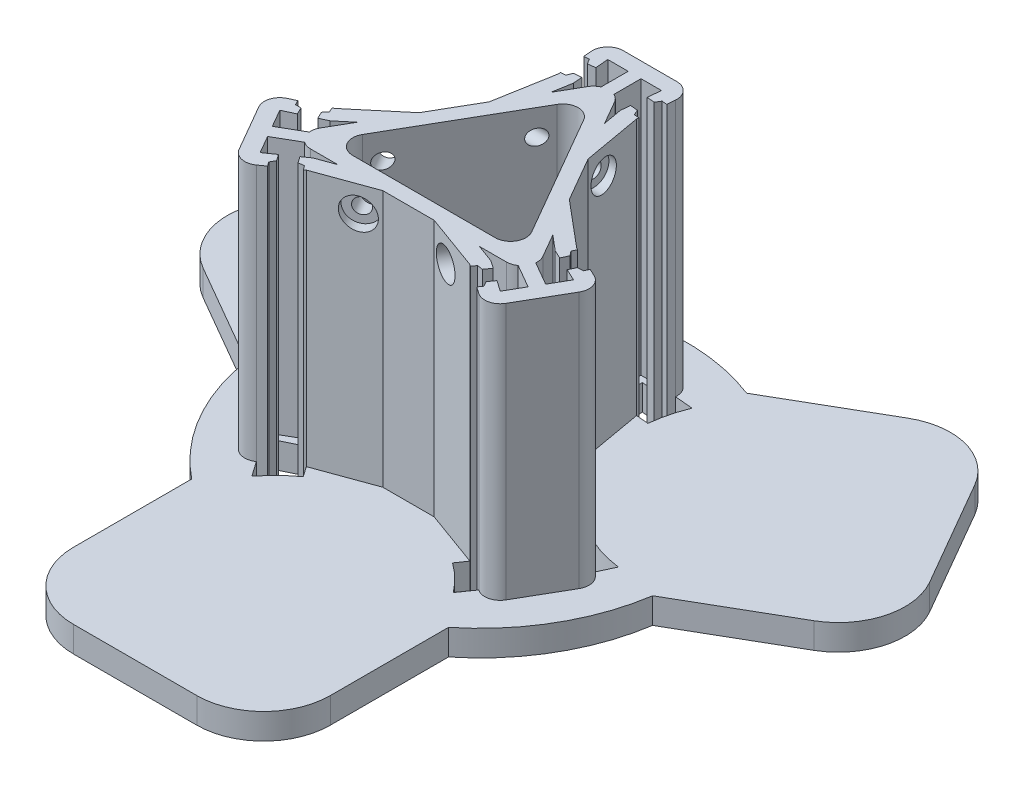
from build123d import *

# Parameters (mm, degrees)
SKETCH_1_R                         = 40
EXTRUDE_1_DEPTH                    = 5
EXTRUDE_2_DEPTH                    = 50
FILLET_1_R                         = 13
FILLET_2_R                         = 3
SKETCH_6_R                         = 3.4999999999999996
SKETCH_6_R_2                       = 1.5000000000000009
SKETCH_6_R_3                       = 1.5000000000000007
CUT_EXTRUDE_1_DEPTH                = 5
FILLET_3_R                         = 3
SKETCH_7_R                         = 1.5000000000000009
CUT_EXTRUDE_2_DEPTH                = 10
SKETCH_9_R                         = 3.0000000000000018
CUT_EXTRUDE_3_DEPTH                = 10
PATTERN_CIRCULAR_1_COUNT           = 3
PATTERN_CIRCULAR_1_COPY_1_SKETCH_R = 3.0000000000000018
PATTERN_CIRCULAR_1_COPY_1_DEPTH    = 10
PATTERN_CIRCULAR_1_COPY_2_SKETCH_R = 3.0000000000000018
PATTERN_CIRCULAR_1_COPY_2_DEPTH    = 10
CUT_EXTRUDE_4_DEPTH                = 10
CHAMFER_1_SIZE                     = 2
EXTRUDE_3_DEPTH                    = 50
CUT_EXTRUDE_5_DEPTH                = 50
CUT_EXTRUDE_6_DEPTH                = 5
PATTERN_CIRCULAR_2_COUNT           = 3


with BuildPart() as part:
    # 草图1 → 凸台-拉伸1 (new body)
    with BuildSketch(Plane(origin=(0, 0, 0), x_dir=(1, 0, 0), z_dir=(0, 1, 0))):
        Circle(SKETCH_1_R)
        with BuildLine():
            Line((-70.71854910221971, 11.961859901384987), (-39.54163456597992, -6.038140098614985))
            ThreePointArc((-39.54163456597992, -6.038140098614977), (-34.64101615137755, 19.999999999999996), (-14.541634565979926, 37.26313009060696))
            Line((-14.541634565979923, 37.26313009060696), (-45.71854910221971, 55.26313009060694))
            Line((-45.71854910221971, 55.26313009060694), (-70.71854910221971, 11.961859901384988))
        make_face()
        with BuildLine():
            ThreePointArc((40, -9.8e-15), (39.88524402983638, -3.0277563773199354), (39.54163456597992, -6.038140098614973))
            Line((39.54163456597992, -6.038140098614959), (70.7185491022197, 11.96185990138505))
            Line((70.7185491022197, 11.961859901385054), (45.71854910221967, 55.263130090606985))
            Line((45.71854910221967, 55.26313009060698), (14.541634565979898, 37.26313009060697))
            ThreePointArc((14.541634565979898, 37.26313009060697), (33.02775637731994, 22.564735954147615), (40, 0))
        make_face()
        with BuildLine():
            ThreePointArc((25, -31.22498999199199), (-7.35e-15, -40), (-25.000000000000007, -31.224989991991983))
            Line((-25.000000000000004, -31.224989991991986), (-25, -67.22498999199198))
            Line((-25, -67.22498999199198), (25.000000000000014, -67.22498999199198))
            Line((25.000000000000014, -67.22498999199198), (25.000000000000004, -31.224989991991986))
        make_face()
    extrude(amount=EXTRUDE_1_DEPTH)

    # 草图3 → 凸台-拉伸2 (add)
    with BuildSketch(Plane(origin=(0, 5, 0), x_dir=(1, 0, 0), z_dir=(0, 1, 0))):
        Polygon((5.0000000000000036, -13.999999999999723), (13.771413200489384, -13.999999999999677), (5.528980942125376, -10.999999999999721), (-5.528980942125042, -10.999999999999783), (-13.771413200488723, -13.999999999999824), (-4.999999999999709, -13.999999999999774), align=None)
        Polygon((23.529502776556207, -4.802432685892536), (14.624355652981862, 2.6698729810779707), (19.01006225322692, -4.926393677636174), (21.903694940095285, -7.354439797949879), (28.59379936192919, -10.474086723707572), (23.36772486513708, -19.525913276291682), (17.32097916567585, -15.291936355891886), (13.771413200489386, -13.999999999999673), (5.0000000000000036, -13.999999999999723), (15.923780094226146, -17.97593079996756), (24.32883832488654, -23.86121593216739), (32.8288383248864, -9.138784067831828), align=None)
        Polygon((-19.01006225322658, -4.926393677636355), (-14.62435565298191, 2.6698729810776634), (-23.5295027765561, -4.802432685893031), (-32.828838324886206, -9.1387840678325), (-24.328838324886046, -23.861215932167887), (-15.923780094225767, -17.975930799967895), (-4.999999999999709, -13.999999999999845), (-13.771413200488727, -13.99999999999982), (-17.32097916567553, -15.291936355892252), (-23.36772486513667, -19.525913276292176), (-28.593799361928973, -10.47408672370817), (-21.90369494009513, -7.354439797950335), align=None)
        Polygon((-6.761788970566114, 10.2882379529202), (-5.2386490527376175, 18.926393677635538), (-9.624355652982096, 11.330127018921829), (-14.62435565298191, 2.6698729810776634), (-19.01006225322658, -4.926393677636355), (-12.290769912691273, 0.7117620470792656), align=None)
        Polygon((5.238649052737051, 18.926393677636717), (9.624355652982118, 11.330127018922184), (7.605722682329952, 22.778363485860595), (8.499999999999662, 32.9999999999999), (-8.500000000000359, 32.99999999999971), (-7.605722682330446, 22.778363485860424), (-9.624355652982153, 11.330127018921862), (-5.238649052737607, 18.92639367763554), (-4.582715774419748, 22.646376153842155), (-5.22607449679251, 29.999999999999748), (5.226074496791905, 29.999999999999854), (4.58271577441929, 22.64637615384222), align=None)
        Polygon((14.624355652982025, 2.6698729810780613), (9.624355652982118, 11.330127018922184), (5.238649052737051, 18.926393677636717), (6.761788970565958, 10.288237952920133), (12.290769912691639, 0.7117620470792474), (19.01006225322692, -4.926393677636167), align=None)
        Polygon((24.248711305964207, -13.99999999999962), (19.01006225322692, -4.926393677636174), (12.2907699126916, 0.7117620470792195), (19.052558883257564, -10.999999999999648), (5.528980942125376, -10.999999999999725), (13.771413200489386, -13.999999999999673), align=None)
        Polygon((-19.0525588832572, -10.999999999999856), (-12.290769912691294, 0.7117620470792758), (-19.01006225322658, -4.926393677636359), (-24.248711305963784, -13.999999999999876), (-13.771413200488727, -13.99999999999982), (-5.528980942125043, -10.999999999999785), align=None)
        Polygon((6.761788970565958, 10.288237952920133), (5.2386490527370455, 18.926393677636717), (0, 27.999999999999755), (-5.238649052737607, 18.92639367763554), (-6.761788970566114, 10.2882379529202), (2.132e-14, 21.999999999999766), align=None)
    extrude(amount=EXTRUDE_2_DEPTH)

    # 圆角1
    fillet_1_edges = [part.edges().sort_by_distance(p)[0] for p in [
        (25.000000000000014, 2.5, 67.22498999199198),
        (-25, 2.5, 67.22498999199198),
        (-70.71854910221971, 2.5, -11.961859901384987),
        (-45.71854910221971, 2.5, -55.26313009060694),
        (45.71854910221967, 2.5, -55.26313009060698),
        (70.7185491022197, 2.5, -11.961859901385052),
    ]]
    fillet(fillet_1_edges, radius=FILLET_1_R)

    # 圆角2
    fillet_2_edges = [part.edges().sort_by_distance(p)[0] for p in [
        (24.248711305964207, 30, 13.99999999999962),
        (-24.248711305963784, 30, 13.999999999999876),
        (-19.0525588832572, 30, 10.999999999999856),
        (2.172e-14, 30, -21.999999999999766),
        (0, 30, -27.999999999999755),
        (19.052558883257564, 30, 10.99999999999965),
    ]]
    fillet(fillet_2_edges, radius=FILLET_2_R)

    # 草图6 → 切除-拉伸1 (cut)
    with BuildSketch(Plane.XZ):
        with Locations(Location((0, 0, 0), (0, 0, 270))):
            Circle(SKETCH_6_R)
        with Locations(Location((0, 6.999999999999999, 0), (0, 0, 270))):
            Circle(SKETCH_6_R_2)
        with Locations(Location((6.999999999999999, 0, 0), (0, 0, 270))):
            Circle(SKETCH_6_R_3)
        with Locations(Location((-6.999999999999999, 0, 0), (0, 0, 90))):
            Circle(SKETCH_6_R_3)
        with Locations(Location((0, -6.999999999999999, 0), (0, 0, 90))):
            Circle(SKETCH_6_R_2)
    extrude(amount=-CUT_EXTRUDE_1_DEPTH, mode=Mode.SUBTRACT)

    # 圆角3
    fillet_3_edges = [part.edges().sort_by_distance(p)[0] for p in [
        (-32.828838324886206, 30, 9.1387840678325),
        (-24.328838324886046, 30, 23.861215932167887),
        (24.32883832488654, 30, 23.86121593216739),
        (32.8288383248864, 30, 9.138784067831828),
        (8.499999999999662, 30, -32.9999999999999),
        (-8.500000000000359, 30, -32.99999999999971),
    ]]
    fillet(fillet_3_edges, radius=FILLET_3_R)

    # 草图7 → 切除-拉伸2 (cut, symmetric)
    with BuildSketch(Plane(origin=(0, 0, 0), x_dir=(0, 0, -1), z_dir=(1, 0, 0))):
        with Locations((15, 50)):
            Circle(SKETCH_7_R)
    cut_extrude_2 = extrude(amount=CUT_EXTRUDE_2_DEPTH, both=True, mode=Mode.SUBTRACT)

    # 草图9 → 切除-拉伸3 (cut)
    with BuildSketch(Plane(origin=(7, 0, 0), x_dir=(0, 0, -1), z_dir=(1, 0, 0))):
        with Locations((15, 50)):
            Circle(SKETCH_9_R)
    cut_extrude_3 = extrude(amount=CUT_EXTRUDE_3_DEPTH, mode=Mode.SUBTRACT)

    # 镜向1: 切除-拉伸3 across plane
    add(cut_extrude_3.mirror(Plane(origin=(0, 0, 0), x_dir=(0, 0, 1), z_dir=(1, 0, 0))), mode=Mode.SUBTRACT)

    # 阵列(圆周)1: 切除-拉伸2, 切除-拉伸3 ×3 about axis
    pattern_circular_1_axis = Axis((-2.9e-16, 0, 1.5e-15), (0, 1, 0))
    add([cut_extrude_2.rotate(pattern_circular_1_axis, i * 360 / PATTERN_CIRCULAR_1_COUNT) for i in range(1, PATTERN_CIRCULAR_1_COUNT)], mode=Mode.SUBTRACT)
    add([cut_extrude_3.rotate(pattern_circular_1_axis, i * 360 / PATTERN_CIRCULAR_1_COUNT) for i in range(1, PATTERN_CIRCULAR_1_COUNT)], mode=Mode.SUBTRACT)

    # 阵列(圆周)1 copy 1 sketch → 阵列(圆周)1 copy 1 (cut)
    with BuildSketch(Plane(origin=(3.4999999999999964, 0, 6.062177826491073), x_dir=(-0.8660254037844387, 0, 0.4999999999999998), z_dir=(0.4999999999999998, 0, 0.8660254037844387))):
        with Locations((15, -50)):
            Circle(PATTERN_CIRCULAR_1_COPY_1_SKETCH_R)
    extrude(amount=PATTERN_CIRCULAR_1_COPY_1_DEPTH, mode=Mode.SUBTRACT)

    # 阵列(圆周)1 copy 2 sketch → 阵列(圆周)1 copy 2 (cut)
    with BuildSketch(Plane(origin=(3.500000000000004, 0, -6.062177826491066), x_dir=(0.8660254037844384, 0, 0.5000000000000004), z_dir=(0.5000000000000004, 0, -0.8660254037844384))):
        with Locations((15, -50)):
            Circle(PATTERN_CIRCULAR_1_COPY_2_SKETCH_R)
    extrude(amount=PATTERN_CIRCULAR_1_COPY_2_DEPTH, mode=Mode.SUBTRACT)

    # 草图10 → 切除-拉伸4 (cut)
    with BuildSketch(Plane(origin=(0, 5, 0), x_dir=(1, 0, 0), z_dir=(0, 1, 0))):
        Polygon((-1.3323e-13, 13.49999999999977), (4.9074772881116235, 13.499999999999817), (2.598076211353357, 17.499999999999794), (-1.7897e-13, 17.499999999999776), align=None)
        Polygon((-4.907477288111908, 13.499999999999725), (-1.3323e-13, 13.49999999999977), (-1.7884e-13, 17.499999999999776), (-2.5980762113532716, 17.499999999999762), align=None)
        Polygon((11.691342951089823, -6.749999999999692), (15.155444566227587, -8.749999999999675), (16.454482671904234, -6.499999999999671), (14.145081595145635, -2.4999999999997904), align=None)
        Polygon((13.856406460550941, -10.99999999999968), (15.155444566227587, -8.749999999999677), (11.691342951089823, -6.749999999999692), (9.23760430703387, -10.999999999999815), align=None)
        Polygon((-15.155444566227395, -8.750000000000039), (-11.691342951089664, -6.750000000000001), (-14.145081595145575, -2.5000000000000746), (-16.4544826719039, -6.499999999999838), align=None)
        Polygon((-13.856406460550563, -10.99999999999983), (-9.23760430703373, -10.999999999999936), (-11.691342951089657, -6.7499999999999964), (-15.155444566227395, -8.750000000000039), align=None)
        with BuildLine():
            Line((-16.4544826719039, -6.499999999999838), (-13.856406460550563, -10.99999999999983))
            ThreePointArc((-13.856406460550563, -10.99999999999983), (-16.454482671903886, -9.499999999999838), (-16.4544826719039, -6.499999999999838))
        make_face()
        with BuildLine():
            ThreePointArc((13.856406460550941, -10.99999999999968), (15.356406460550899, -10.598076211353012), (16.454482671904202, -9.499999999999748))
            Line((16.45448267190422, -9.499999999999712), (15.155444566227555, -8.749999999999726))
            Line((15.155444566227587, -8.749999999999677), (13.856406460550941, -10.99999999999968))
        make_face()
        with BuildLine():
            Line((15.155444566227555, -8.749999999999726), (16.45448267190422, -9.499999999999712))
            ThreePointArc((16.454482671904202, -9.499999999999748), (16.856406460550925, -7.999999999999714), (16.454482671904234, -6.499999999999671))
            Line((16.454482671904234, -6.499999999999671), (15.155444566227587, -8.749999999999677))
        make_face()
        with BuildLine():
            ThreePointArc((13.856406460550941, -10.99999999999968), (15.356406460550899, -10.598076211353012), (16.454482671904202, -9.499999999999748))
            Line((16.45448267190422, -9.499999999999712), (15.155444566227555, -8.749999999999726))
            Line((15.155444566227587, -8.749999999999677), (13.856406460550941, -10.99999999999968))
        make_face()
        with BuildLine():
            Line((15.155444566227555, -8.749999999999726), (16.45448267190422, -9.499999999999712))
            ThreePointArc((16.454482671904202, -9.499999999999748), (16.856406460550925, -7.999999999999714), (16.454482671904234, -6.499999999999671))
            Line((16.454482671904234, -6.499999999999671), (15.155444566227587, -8.749999999999677))
        make_face()
        with BuildLine():
            Line((2.598076211353357, 17.499999999999794), (-2.598076211353272, 17.499999999999762))
            ThreePointArc((-2.598076211353272, 17.499999999999762), (3.271e-14, 18.999999999999776), (2.598076211353357, 17.499999999999794))
        make_face()
    extrude(amount=-CUT_EXTRUDE_4_DEPTH, mode=Mode.SUBTRACT)

    # 倒角1
    chamfer_1_edges = [part.edges().sort_by_distance(p)[0] for p in [
        (9.526279441628773, 5, -5.500000000000091),
        (-9.526279441628683, 5, -5.49999999999979),
        (7.105e-14, 5, 10.999999999999753),
    ]]
    chamfer(chamfer_1_edges, length=CHAMFER_1_SIZE)

    # 草图12 → 凸台-拉伸3 (add)
    with BuildSketch(Plane(origin=(0, 55, 0), x_dir=(1, 0, 0), z_dir=(0, 1, 0))):
        with BuildLine():
            Line((-1.2500000000000002, 29.999999999999854), (1.2500000000000002, 29.999999999999854))
            Line((1.2500000000000002, 29.999999999999854), (1.25, 24.7271780286587))
            ThreePointArc((1.25, 24.7271780286587), (-3.49e-15, 24.999999999999755), (-1.25, 24.727178028658667))
            Line((-1.25, 24.727178028658667), (-1.2500000000000002, 29.999999999999854))
        make_face()
        with BuildLine():
            Line((25.355762113533036, -16.08253175473047), (20.78936433671885, -13.446120769059895))
            ThreePointArc((20.78936433671885, -13.446120769059895), (21.65063509461076, -12.499999999999872), (22.03936433671883, -11.281057259598782))
            Line((22.03936433671883, -11.281057259598782), (26.605762113533036, -13.917468245269372))
            Line((26.605762113533036, -13.917468245269372), (25.355762113533036, -16.08253175473047))
        make_face()
        with BuildLine():
            Line((-26.60576211353303, -13.91746824526939), (-22.039364336718847, -11.281057259598812))
            ThreePointArc((-22.039364336718847, -11.281057259598812), (-21.65063509461075, -12.499999999999893), (-20.789364336718815, -13.446120769059894))
            Line((-20.789364336718815, -13.446120769059894), (-25.35576211353303, -16.082531754730486))
            Line((-25.35576211353303, -16.082531754730486), (-26.60576211353303, -13.91746824526939))
        make_face()
    extrude(amount=-EXTRUDE_3_DEPTH)

    # 草图14 → 切除-拉伸5 (cut)
    with BuildSketch(Plane(origin=(0, 55, 0), x_dir=(1, 0, 0), z_dir=(0, 1, 0))):
        Polygon((16.272007612594383, -18.219762333341055), (20.367767834039373, -21.08764451509624), (20.941344270390413, -20.26849247080724), (20.408980444276935, -19.285340012311707), (21.269345098803488, -18.056611945878206), (18.811888965936493, -16.335882636825097), (17.951524311409937, -17.564610703258595), (16.845584048945422, -17.400610289052057), align=None)
        Polygon((23.914780837885473, -4.982090796409482), (23.492162576144796, -5.8883985834461505), (24.1871612323111, -6.764170738705166), (23.55323383970005, -8.123632419260138), (26.27215720081001, -9.391487204482212), (26.906084593421067, -8.032025523927246), (28.02370151132806, -8.001489892149609), (28.446319773068737, -7.095182105112941), align=None)
        Polygon((-23.914780837885385, -4.982090796409988), (-28.44631977306861, -7.095182105113538), (-28.0237015113279, -8.001489892150184), (-26.9060845934209, -8.032025523927798), (-26.272157200809836, -9.391487204482766), (-23.5532338396999, -8.123632419260636), (-24.187161232310967, -6.7641707387056655), (-23.492162576144676, -5.8883985834466355), align=None)
        Polygon((-16.272007612593992, -18.219762333341386), (-16.845584048945064, -17.400610289052402), (-17.951524311409575, -17.564610703258968), (-18.81188896593614, -16.335882636825477), (-21.2693450988031, -18.05661194587864), (-20.40898044427654, -19.285340012312126), (-20.941344270389997, -20.268492470807672), (-20.367767834038922, -21.087644515096652), align=None)
        Polygon((7.642773225290993, 23.201853129751044), (8.078551939029223, 28.182826620209774), (7.082357240937477, 28.269982362957425), (6.497104149143955, 27.317365536239503), (5.0028121020063345, 27.44809915036097), (4.7413448737633965, 24.459515056085728), (6.235636920901019, 24.328781441964257), (6.646578527199244, 23.28900887249869), align=None)
        Polygon((-7.64277322529149, 23.201853129750866), (-6.646578527199741, 23.28900887249855), (-6.235636920901537, 24.328781441964125), (-4.741344873763918, 24.45951505608561), (-5.0028121020069225, 27.448099150360843), (-6.497104149144536, 27.31736553623936), (-7.082357240938075, 28.269982362957272), (-8.078551939029824, 28.182826620209582), align=None)
    extrude(amount=-CUT_EXTRUDE_5_DEPTH, mode=Mode.SUBTRACT)

    # 草图15 → 切除-拉伸6 (cut)
    # profile 1 of 4: a face of its own
    with BuildSketch(Plane(origin=(0, 5, 0), x_dir=(1, 0, 0), z_dir=(0, 1, 0))):
        with BuildLine():
            Line((11.49645321905575, 29.451412945787773), (8.21465859106768, 29.738532771757008))
            Line((8.21465859106768, 29.738532771757008), (8.078551939029753, 28.182826620209852))
            Line((8.078551939029753, 28.182826620209852), (7.08235724093799, 28.269982362957514))
            Line((7.08235724093799, 28.269982362957514), (6.49710414914445, 27.31736553623962))
            Line((6.49710414914445, 27.31736553623962), (5.002812102006857, 27.448099150361077))
            Line((5.002812102006857, 27.448099150361077), (5.089967844754482, 28.444293848452826))
            Line((5.089967844754487, 28.444293848452826), (5.111756780441399, 28.693342522975765))
            Line((5.111756780441399, 28.693342522975765), (2.578254569280295, 28.914995245470184))
            Line((2.578254569280295, 28.914995245470184), (2.9755493184889295, 23.359227352347673))
            Line((2.9755493184889295, 23.359227352347673), (4.6324001953293, 23.214271683471182))
            Line((4.6324001953293, 23.214271683471182), (4.654189131016214, 23.463320357994107))
            Line((4.6541891310162145, 23.463320357994107), (4.741344873763868, 24.45951505608585))
            Line((4.741344873763868, 24.45951505608585), (6.23563692090149, 24.328781441964374))
            Line((6.23563692090149, 24.328781441964374), (6.646578527199701, 23.289008872498798))
            Line((6.646578527199701, 23.289008872498798), (7.642773225291444, 23.201853129751118))
            Line((7.642773225291444, 23.201853129751118), (7.60572268233041, 22.778363485860677))
            Line((7.605722682330409, 22.778363485860673), (10.024471059380858, 22.56675042294705))
            ThreePointArc((10.024471059380858, 22.56675042294705), (10.644354614308423, 26.059928636160116), (11.757306504129204, 29.428591240500367))
            Line((11.757306504129202, 29.428591240500367), (11.496453219055752, 29.45141294578779))
        make_face()
        with BuildLine():
            Line((2.84852977404805, 28.640394269635024), (4.84091917023155, 28.46608278413974))
            Line((4.84091917023155, 28.46608278413974), (4.731974491796992, 27.220839411525056))
            Line((4.731974491796992, 27.220839411525056), (6.629235759165825, 27.054850558883476))
            Line((6.629235759165825, 27.054850558883476), (7.214488850959364, 28.00746738560138))
            Line((7.214488850959364, 28.00746738560138), (8.305811677865774, 27.91198900999999))
            Line((8.305811677865774, 27.91198900999999), (8.441918329903688, 29.467695161547155))
            Line((8.441918329903688, 29.467695161547155), (11.398931423855, 29.20899003792871))
            ThreePointArc((11.398931423855, 29.20899003792871), (10.390538660119788, 26.075717360609108), (9.802523214694794, 22.837123302636925))
            Line((9.802523214694798, 22.837123302636925), (7.876560292540254, 23.0056232246967))
            Line((7.876560292540254, 23.0056232246967), (7.913610835501288, 23.42911286858714))
            Line((7.913610835501288, 23.42911286858714), (6.822288008594884, 23.52459124418854))
            Line((6.822288008594884, 23.52459124418854), (6.41134640229668, 24.564363813654126))
            Line((6.41134640229668, 24.564363813654126), (4.514085134927848, 24.73035266629571))
            Line((4.514085134927848, 24.73035266629571), (4.4051404564932755, 23.485109293681024))
            Line((4.4051404564932755, 23.485109293681024), (3.209706818783173, 23.589696184978195))
            Line((3.209706818783173, 23.589696184978195), (2.84852977404805, 28.640394269635024))
        make_face(mode=Mode.SUBTRACT)
    # profile 2 of 4: a face of its own
    with BuildSketch(Plane(origin=(0, 5, 0), x_dir=(1, 0, 0), z_dir=(0, 1, 0))):
        with BuildLine():
            ThreePointArc((11.398931423855, 29.20899003792871), (10.390538660119788, 26.07571736060911), (9.802523214694798, 22.837123302636925))
            Line((9.802523214694798, 22.837123302636925), (7.876560292540254, 23.0056232246967))
            Line((7.876560292540254, 23.0056232246967), (7.913610835501288, 23.42911286858714))
            Line((7.913610835501288, 23.42911286858714), (6.822288008594884, 23.52459124418854))
            Line((6.822288008594884, 23.52459124418854), (6.41134640229668, 24.564363813654126))
            Line((6.41134640229668, 24.564363813654126), (4.514085134927848, 24.73035266629571))
            Line((4.514085134927848, 24.73035266629571), (4.4051404564932755, 23.485109293681024))
            Line((4.4051404564932755, 23.485109293681024), (3.209706818783173, 23.589696184978195))
            Line((3.209706818783173, 23.589696184978195), (2.84852977404805, 28.640394269635024))
            Line((2.84852977404805, 28.640394269635024), (4.84091917023155, 28.46608278413974))
            Line((4.84091917023155, 28.46608278413974), (4.731974491796992, 27.220839411525056))
            Line((4.731974491796992, 27.220839411525056), (6.629235759165825, 27.054850558883476))
            Line((6.629235759165825, 27.054850558883476), (7.214488850959364, 28.00746738560138))
            Line((7.214488850959364, 28.00746738560138), (8.305811677865774, 27.91198900999999))
            Line((8.305811677865774, 27.91198900999999), (8.441918329903688, 29.467695161547155))
            Line((8.441918329903688, 29.467695161547155), (11.398931423855, 29.20899003792871))
        make_face()
    # profile 3 of 4: a face of its own
    with BuildSketch(Plane(origin=(0, 5, 0), x_dir=(1, 0, 0), z_dir=(0, 1, 0))):
        with BuildLine():
            Line((28.446319773068737, -7.095182105112934), (29.86165414715138, -7.755163362597528))
            Line((29.86165414715138, -7.755163362597528), (31.253898397925887, -4.76948593177191))
            Line((31.25389839792589, -4.769485931771912), (31.364560863926013, -4.532169507593997))
            ThreePointArc((31.364560863926013, -4.532169507593995), (27.890737526878333, -3.8116828151985374), (24.555614676825723, -2.601928614547454))
            Line((24.555614676825723, -2.6019286145474543), (24.449945650575362, -2.828536572624861))
            Line((24.44994565057536, -2.82853657262486), (23.52950277655632, -4.802432685892411))
            Line((23.52950277655632, -4.802432685892411), (23.914780837885473, -4.982090796409482))
            Line((23.914780837885473, -4.982090796409482), (23.492162576144796, -5.888398583446149))
            Line((23.492162576144796, -5.888398583446149), (24.187161232311098, -6.764170738705163))
            Line((24.187161232311098, -6.764170738705163), (23.553233839700045, -8.123632419260137))
            Line((23.553233839700045, -8.123632419260137), (22.646926052663517, -7.701014157519319))
            Line((22.646926052663513, -7.701014157519324), (22.420349105904346, -7.5953595920841455))
            Line((22.420349105904346, -7.5953595920841455), (21.717458959153785, -9.10271237614867))
            Line((21.717458959153785, -9.10271237614867), (26.33024771752353, -12.224663668314758))
            Line((26.33024771752353, -12.224663668314758), (27.40504193460591, -9.919760031657987))
            Line((27.40504193460591, -9.919760031657987), (27.17846498784676, -9.814105466222813))
            Line((27.17846498784676, -9.814105466222811), (26.272157200810007, -9.391487204482209))
            Line((26.272157200810007, -9.391487204482209), (26.906084593421063, -8.03202552392724))
            Line((26.906084593421063, -8.03202552392724), (28.023701511328063, -8.001489892149609))
            Line((28.023701511328063, -8.001489892149609), (28.446319773068737, -7.095182105112934))
        make_face()
        with BuildLine():
            Line((30.995193103660252, -4.732730829908913), (29.74073176582739, -7.42293185040319))
            Line((29.74073176582739, -7.42293185040319), (28.32539739174485, -6.762950592918492))
            Line((28.32539739174485, -6.762950592918492), (27.862422677074534, -7.755803072549989))
            Line((27.862422677074534, -7.755803072549989), (26.744805759167548, -7.786338704327624))
            Line((26.744805759167548, -7.786338704327624), (25.93992568861577, -9.51240958580608))
            Line((25.93992568861577, -9.51240958580608), (27.072810422411578, -10.04068241298197))
            Line((27.072810422411578, -10.04068241298197), (26.227573898930164, -11.853297987055262))
            Line((26.227573898930164, -11.853297987055262), (22.034129573139488, -9.015160448722456))
            Line((22.034129573139488, -9.015160448722456), (22.541271487228336, -7.92759110427848))
            Line((22.541271487228336, -7.92759110427848), (23.674156221024145, -8.45586393145436))
            Line((23.674156221024145, -8.45586393145436), (24.479036291575913, -6.729793049975882))
            Line((24.479036291575913, -6.729793049975882), (23.784037635409607, -5.854020894716861))
            Line((23.784037635409607, -5.854020894716861), (24.24701235007992, -4.861168415085372))
            Line((24.24701235007992, -4.861168415085372), (23.86173428875065, -4.681510304568422))
            Line((23.86173428875065, -4.681510304568422), (24.678790536788473, -2.9293275262057445))
            ThreePointArc((24.678790536788473, -2.9293275262057463), (27.7775029862502, -4.0393882416361855), (30.995193103660252, -4.732730829908917))
        make_face(mode=Mode.SUBTRACT)
    # profile 4 of 4: a face of its own
    with BuildSketch(Plane(origin=(0, 5, 0), x_dir=(1, 0, 0), z_dir=(0, 1, 0))):
        with BuildLine():
            ThreePointArc((24.678790536788473, -2.9293275262057445), (27.777502986250198, -4.039388241636182), (30.995193103660252, -4.732730829908913))
            Line((30.995193103660252, -4.732730829908913), (29.74073176582739, -7.42293185040319))
            Line((29.74073176582739, -7.42293185040319), (28.32539739174485, -6.762950592918492))
            Line((28.32539739174485, -6.762950592918492), (27.862422677074534, -7.755803072549989))
            Line((27.862422677074534, -7.755803072549989), (26.744805759167548, -7.786338704327624))
            Line((26.744805759167548, -7.786338704327624), (25.93992568861577, -9.51240958580608))
            Line((25.93992568861577, -9.51240958580608), (27.072810422411578, -10.04068241298197))
            Line((27.072810422411578, -10.04068241298197), (26.227573898930164, -11.853297987055262))
            Line((26.227573898930164, -11.853297987055262), (22.034129573139488, -9.015160448722456))
            Line((22.034129573139488, -9.015160448722456), (22.541271487228336, -7.92759110427848))
            Line((22.541271487228336, -7.92759110427848), (23.674156221024145, -8.45586393145436))
            Line((23.674156221024145, -8.45586393145436), (24.479036291575913, -6.729793049975882))
            Line((24.479036291575913, -6.729793049975882), (23.784037635409607, -5.854020894716861))
            Line((23.784037635409607, -5.854020894716861), (24.24701235007992, -4.861168415085372))
            Line((24.24701235007992, -4.861168415085372), (23.86173428875065, -4.681510304568422))
            Line((23.86173428875065, -4.681510304568422), (24.678790536788473, -2.9293275262057445))
        make_face()
    cut_extrude_6 = extrude(amount=-CUT_EXTRUDE_6_DEPTH, mode=Mode.SUBTRACT)

    # 阵列(圆周)2: 切除-拉伸6 ×3 about axis
    pattern_circular_2_axis = Axis((-5e-16, 0, 1.47e-15), (0, 1, 0))
    for i in range(1, PATTERN_CIRCULAR_2_COUNT):
        add(cut_extrude_6.rotate(pattern_circular_2_axis, i * 360 / PATTERN_CIRCULAR_2_COUNT), mode=Mode.SUBTRACT)


solid = part.part
